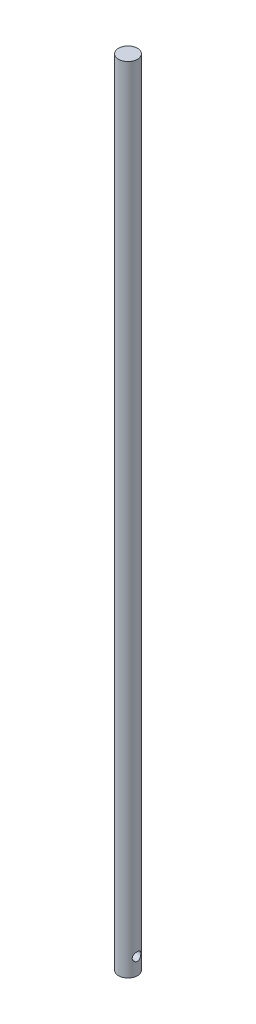
from build123d import *

# Parameters (mm, degrees)
SKETCH_1_R          = 3
EXTRUDE_1_DEPTH     = 250
SKETCH_2_R          = 1.35
CUT_EXTRUDE_1_DEPTH = 251.089983806


with BuildPart() as part:
    # 草图1 → 凸台-拉伸1 (new body)
    with BuildSketch(Plane(origin=(0, 0, 0), x_dir=(1, 0, 0), z_dir=(0, 1, 0))):
        with Locations(Location((0, 0, 0), (0, 0, 270))):
            Circle(SKETCH_1_R)
    extrude(amount=EXTRUDE_1_DEPTH)

    # 草图2 → 切除-拉伸1 (cut, through all)
    with BuildSketch(Plane(origin=(3, 0, 0), x_dir=(0, 0, -1), z_dir=(1, 0, 0))):
        with Locations((0, 5.265746638)):
            Circle(SKETCH_2_R)
    extrude(amount=-CUT_EXTRUDE_1_DEPTH, mode=Mode.SUBTRACT)


solid = part.part
